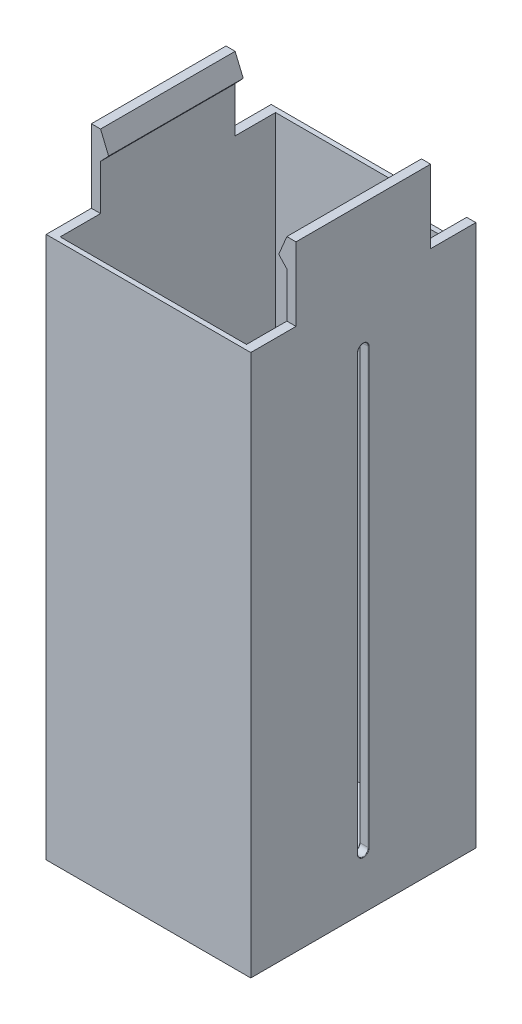
from build123d import *

# Parameters (mm, degrees)
SKETCH1_W           = 38
SKETCH1_H           = 41.8
SKETCH1_W_2         = 34.6
SKETCH1_H_2         = 40
BOSS_EXTRUDE1_DEPTH = 100
SKETCH2_W           = 1.7
SKETCH2_H           = 25
BOSS_EXTRUDE2_DEPTH = 13.6
BOSS_EXTRUDE5_DEPTH = 25
SKETCH6_W           = 38
SKETCH6_H           = 41.8
BOSS_EXTRUDE6_DEPTH = 0.6
SKETCH7_W           = 13.3
SKETCH7_H           = 4.4
CUT_EXTRUDE1_DEPTH  = 10
CUT_EXTRUDE2_DEPTH  = 10
FILLET1_R           = 0.1


with BuildPart() as part:
    # Sketch1 → Boss-Extrude1 (new body)
    with BuildSketch(Plane(origin=(0, 0, 0), x_dir=(1, 0, 0), z_dir=(0, 1, 0))):
        Rectangle(SKETCH1_W, SKETCH1_H)
        Rectangle(SKETCH1_W_2, SKETCH1_H_2, mode=Mode.SUBTRACT)
    extrude(amount=BOSS_EXTRUDE1_DEPTH)

    # Sketch2 → Boss-Extrude2 (add)
    with BuildSketch(Plane(origin=(0, 100, 0), x_dir=(1, 0, 0), z_dir=(0, 1, 0))):
        with Locations((18.15, 0)):
            Rectangle(SKETCH2_W, SKETCH2_H)
        with Locations((-18.15, 0)):
            Rectangle(SKETCH2_W, SKETCH2_H)
    extrude(amount=BOSS_EXTRUDE2_DEPTH)

    # Sketch5 → Boss-Extrude5 (add)
    with BuildSketch(Plane.XY.offset(12.5)):
        Polygon((-15.8, 110), (-17.3, 108.4), (-17.3, 113.6), align=None)
        Polygon((17.3, 108.4), (17.3, 113.6), (15.8, 110), align=None)
    extrude(amount=-BOSS_EXTRUDE5_DEPTH)

    # Sketch6 → Boss-Extrude6 (add)
    with BuildSketch(Plane.XZ):
        Rectangle(SKETCH6_W, SKETCH6_H)
    extrude(amount=BOSS_EXTRUDE6_DEPTH)

    # Sketch7 → Cut-Extrude1 (cut)
    with BuildSketch(Plane(origin=(0, 0, -20.9), x_dir=(-1, 0, 0), z_dir=(0, 0, -1))):
        with Locations((-10.65, 97.8)):
            Rectangle(SKETCH7_W, SKETCH7_H)
    extrude(amount=-CUT_EXTRUDE1_DEPTH, mode=Mode.SUBTRACT)

    # Sketch8 → Cut-Extrude2 (cut)
    with BuildSketch(Plane(origin=(19, 0, 0), x_dir=(0, 0, -1), z_dir=(1, 0, 0))):
        with BuildLine():
            Line((-1, 9.4), (-1, 90))
            ThreePointArc((-1, 90), (0, 91), (1, 90))
            Line((1, 90), (1, 9.4))
            ThreePointArc((1, 9.4), (0, 8.4), (-1, 9.4))
        make_face()
    extrude(amount=-CUT_EXTRUDE2_DEPTH, mode=Mode.SUBTRACT)

    # Fillet1
    fillet1_edges = [part.edges().sort_by_distance(p)[0] for p in [
        (17.3, 49.7, -1),
        (17.3, 91, 0),
        (17.3, 49.7, 1),
        (17.3, 8.4, 0),
        (19, 8.4, 0),
        (19, 49.7, -1),
        (19, 91, 0),
        (19, 49.7, 1),
    ]]
    fillet(fillet1_edges, radius=FILLET1_R)


solid = part.part
